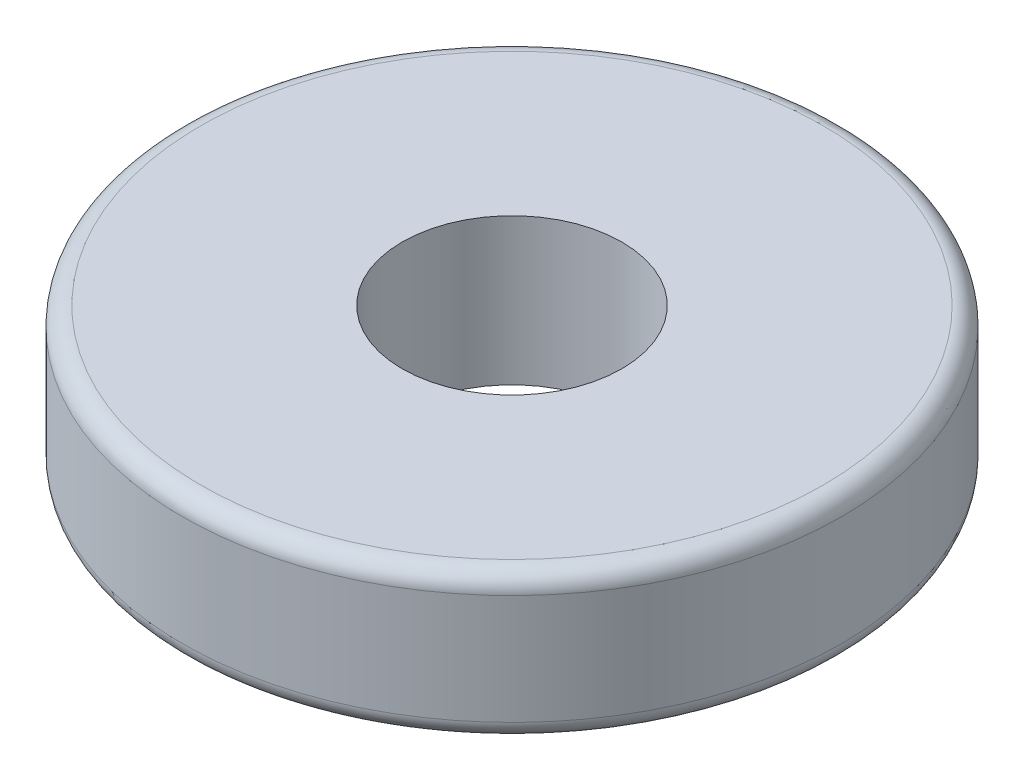
from build123d import *

# Parameters (mm, degrees)
SKETCH_1_W = 12
SKETCH_1_H = 7


with BuildPart() as part:
    # 草图1 → 旋转3 (revolve)
    with BuildSketch(Plane.XY):
        with BuildLine():
            Line((7.5, 5), (7.5, -5))
            Line((7.5, -5), (21.25, -5))
            ThreePointArc((21.25, -5), (22.133883476, -4.633883476), (22.5, -3.75))
            Line((22.5, -3.75), (22.5, 3.75))
            ThreePointArc((22.5, 3.75), (22.133883476, 4.633883476), (21.25, 5))
            Line((21.25, 5), (7.5, 5))
        make_face()
        with Locations((15, 0)):
            Rectangle(SKETCH_1_W, SKETCH_1_H, mode=Mode.SUBTRACT)
    revolve(axis=Axis((0, -346.416551839, 0), (0, 1, 0)))


solid = part.part
